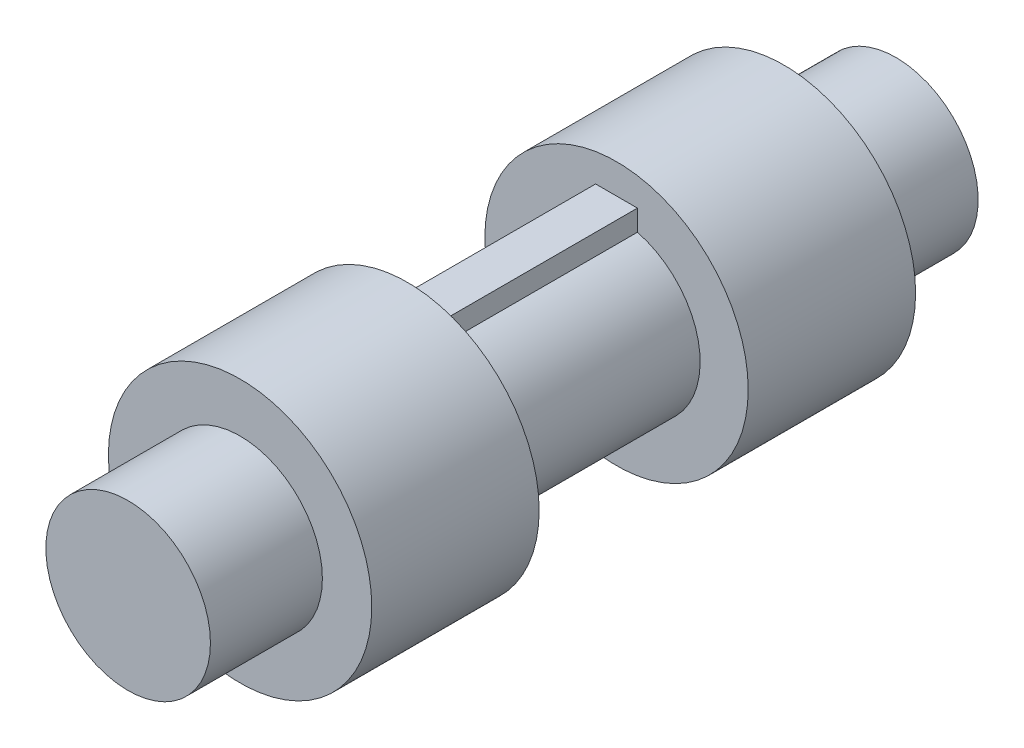
from build123d import *

# Parameters (mm, degrees)
SKETCH1_R           = 12.5
BOSS_EXTRUDE1_DEPTH = 17
SKETCH2_R           = 20
BOSS_EXTRUDE2_DEPTH = 25.425
SKETCH3_R           = 12.7
BOSS_EXTRUDE3_DEPTH = 31.75
SKETCH6_W           = 6.35
SKETCH6_H           = 3.175
BOSS_EXTRUDE6_DEPTH = 31.75
SKETCH4_R           = 20
BOSS_EXTRUDE4_DEPTH = 25.425
SKETCH5_R           = 12.5
BOSS_EXTRUDE5_DEPTH = 17


with BuildPart() as part:
    # Sketch1 → Boss-Extrude1 (new body)
    with BuildSketch(Plane.XY):
        Circle(SKETCH1_R)
    extrude(amount=-BOSS_EXTRUDE1_DEPTH)

    # Sketch2 → Boss-Extrude2 (add)
    with BuildSketch(Plane(origin=(0, 0, -17), x_dir=(-1, 0, 0), z_dir=(0, 0, -1))):
        with Locations(Location((0, 0, 0), (0, 0, 180))):
            Circle(SKETCH2_R)
    extrude(amount=BOSS_EXTRUDE2_DEPTH)

    # Sketch3 → Boss-Extrude3 (add)
    with BuildSketch(Plane(origin=(0, 0, -42.425), x_dir=(-1, 0, 0), z_dir=(0, 0, -1))):
        Circle(SKETCH3_R)
    extrude(amount=BOSS_EXTRUDE3_DEPTH)

    # Sketch6 → Boss-Extrude6 (add)
    with BuildSketch(Plane(origin=(0, 0, -74.175), x_dir=(-1, 0, 0), z_dir=(0, 0, -1))):
        with Locations((0, 13.884222124)):
            Rectangle(SKETCH6_W, SKETCH6_H)
    extrude(amount=-BOSS_EXTRUDE6_DEPTH)

    # Sketch4 → Boss-Extrude4 (add)
    with BuildSketch(Plane(origin=(0, 0, -74.175), x_dir=(-1, 0, 0), z_dir=(0, 0, -1))):
        with Locations(Location((0, 0, 0), (0, 0, 180))):
            Circle(SKETCH4_R)
    extrude(amount=BOSS_EXTRUDE4_DEPTH)

    # Sketch5 → Boss-Extrude5 (add)
    with BuildSketch(Plane(origin=(0, 0, -99.6), x_dir=(-1, 0, 0), z_dir=(0, 0, -1))):
        with Locations(Location((0, 0, 0), (0, 0, 180))):
            Circle(SKETCH5_R)
    extrude(amount=BOSS_EXTRUDE5_DEPTH)


solid = part.part
